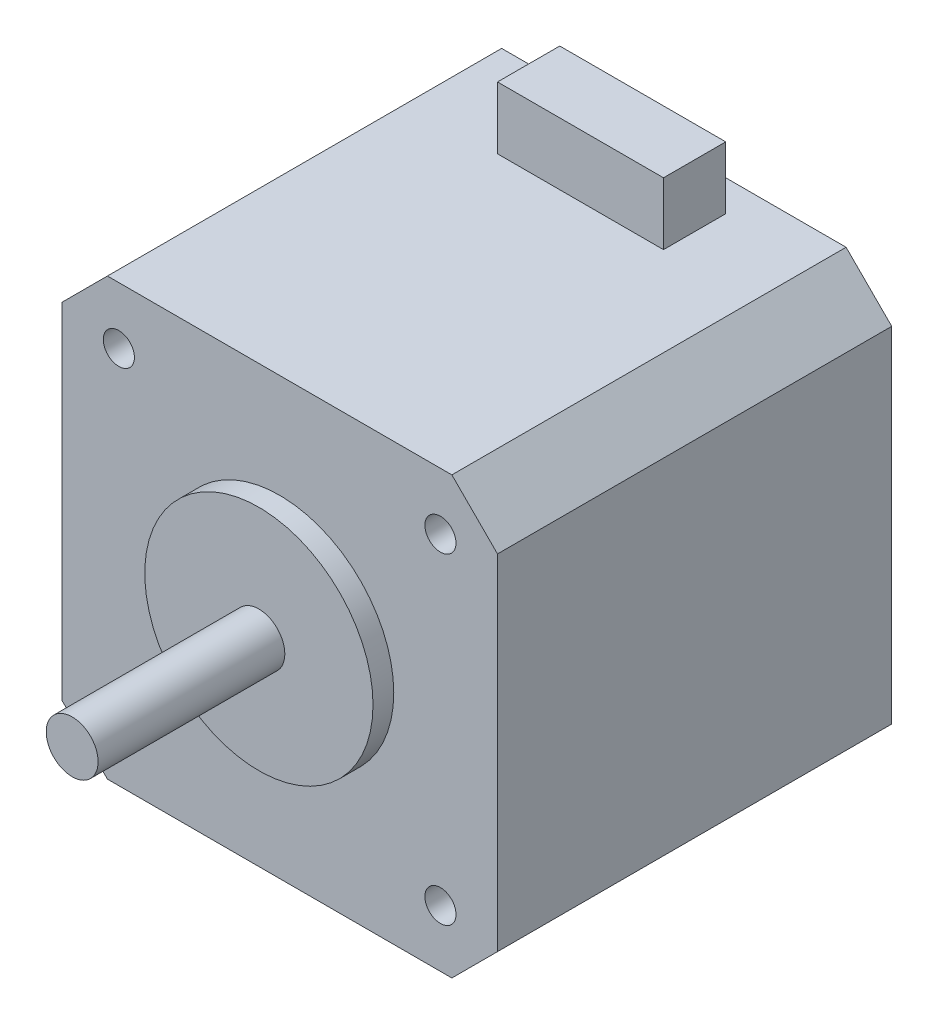
from build123d import *

# Parameters (mm, degrees)
SKETCH_1_R      = 1.5
EXTRUDE_1_DEPTH = 38
SKETCH_2_R      = 11
EXTRUDE_2_DEPTH = 2
SKETCH_3_R      = 2.5
EXTRUDE_3_DEPTH = 20
SKETCH_4_W      = 16
SKETCH_4_H      = 6
EXTRUDE_4_DEPTH = 6


with BuildPart() as part:
    # 草图1 → 凸台-拉伸1 (new body)
    with BuildSketch(Plane.XY):
        Polygon((21, 0), (21, 16.6), (16.6, 21), (0, 21), (-16.6, 21), (-21, 16.6), (-21, 0), (-21, -16.6), (-16.6, -21), (0, -21), (16.6, -21), (21, -16.6), align=None)
        with Locations((15.5, 15.5)):
            Circle(SKETCH_1_R, mode=Mode.SUBTRACT)
        with Locations((15.5, -15.5)):
            Circle(SKETCH_1_R, mode=Mode.SUBTRACT)
        with Locations((-15.5, -15.5)):
            Circle(SKETCH_1_R, mode=Mode.SUBTRACT)
        with Locations((-15.5, 15.5)):
            Circle(SKETCH_1_R, mode=Mode.SUBTRACT)
    extrude(amount=EXTRUDE_1_DEPTH)

    # 草图2 → 凸台-拉伸2 (add)
    with BuildSketch(Plane.XY.offset(38)):
        Circle(SKETCH_2_R)
    extrude(amount=EXTRUDE_2_DEPTH)

    # 草图3 → 凸台-拉伸3 (add)
    with BuildSketch(Plane.XY.offset(38)):
        Circle(SKETCH_3_R)
    extrude(amount=EXTRUDE_3_DEPTH)

    # 草图4 → 凸台-拉伸4 (add)
    with BuildSketch(Plane(origin=(0, 21, 0), x_dir=(1, 0, 0), z_dir=(0, 1, 0))):
        with Locations((0, -6)):
            Rectangle(SKETCH_4_W, SKETCH_4_H)
    extrude(amount=EXTRUDE_4_DEPTH)


solid = part.part
